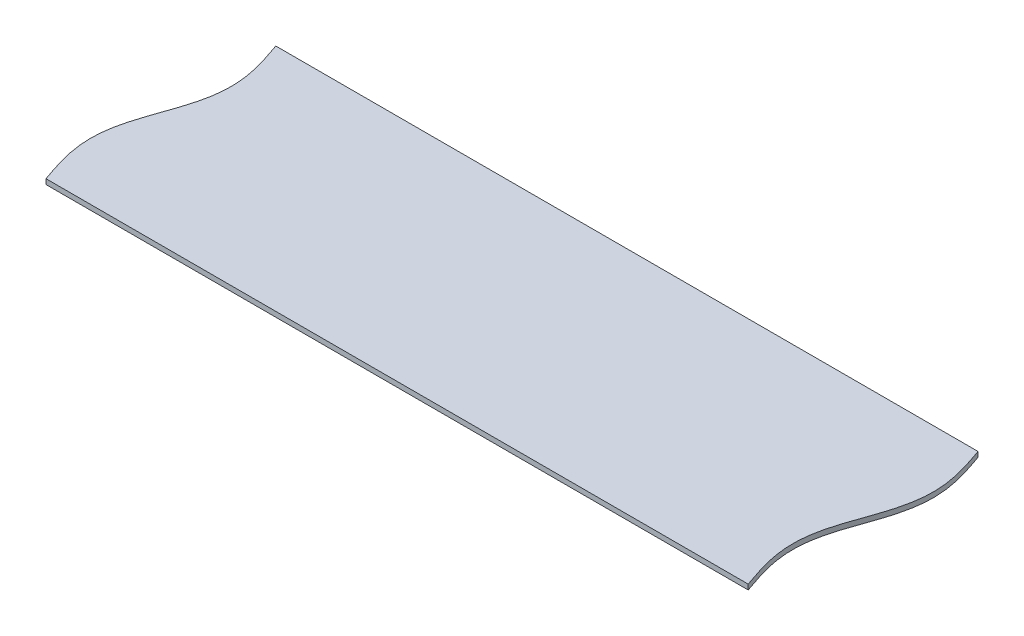
from build123d import *

# Parameters (mm, degrees)
BOSS_EXTRUDE1_DEPTH = 0.4


with BuildPart() as part:
    # Sketch1 → Boss-Extrude1 (new body)
    with BuildSketch(Plane(origin=(0, 0, 0), x_dir=(1, 0, 0), z_dir=(0, 1, 0))):
        with BuildLine():
            Line((0, 0), (55, 0))
            add(Edge.make_bspline(
                [(55, 0), (55.039665895, -0.11362906), (55.127828783, -0.366251213), (55.314067233, -0.905134946), (55.447833384, -1.324433303), (55.628652948, -1.92673847), (55.760019444, -2.450220955), (55.886445316, -3.059977501), (55.96864422, -3.682291541), (56.009573569, -4.325950267), (55.997152388, -4.960850874), (55.937709737, -5.59879764), (55.832282967, -6.227382827), (55.653956328, -7.005059201), (55.379683242, -7.921385768), (55.010484997, -8.974835885), (54.637099515, -10.03406897), (54.358100832, -10.958556195), (54.17500872, -11.74266605), (54.067304208, -12.380419561), (54.004765193, -13.014760212), (53.992375448, -13.655474375), (54.027833685, -14.28923275), (54.103689584, -14.849735384), (54.181675783, -15.270577843), (54.256538187, -15.59642759), (54.340386039, -15.95569417), (54.49812362, -16.501397065), (54.626404098, -16.921778114), (54.868150927, -17.622263401), (54.95612701, -17.874315955), (55, -18)],
                knots=[0.085661925, 0.085661925, 0.085661925, 0.085661925, 0.085661925, 0.111326291, 0.139967508, 0.162510207, 0.185052906, 0.213694134, 0.242335335, 0.270976523, 0.299617709, 0.328258916, 0.356900078, 0.385541278, 0.414182527, 0.471334271, 0.528616704, 0.58589912, 0.615912527, 0.644553724, 0.673194931, 0.701836107, 0.730477286, 0.7591185, 0.787759673, 0.802080278, 0.80924058, 0.816400883, 0.859983468, 0.888624685, 0.917265902, 0.917265902, 0.917265902, 0.917265902, 0.917265902], degree=4))
            Line((55, -18), (0, -18))
            add(Edge.make_bspline(
                [(0, 0), (0.039665895, -0.11362906), (0.127828783, -0.366251213), (0.314067233, -0.905134946), (0.447833384, -1.324433303), (0.628652948, -1.92673847), (0.760019444, -2.450220955), (0.886445316, -3.059977501), (0.96864422, -3.682291541), (1.009573569, -4.325950267), (0.997152388, -4.960850874), (0.937709737, -5.59879764), (0.832282967, -6.227382827), (0.653956328, -7.005059201), (0.379683242, -7.921385768), (0.010484997, -8.974835885), (-0.362900485, -10.03406897), (-0.641899168, -10.958556195), (-0.82499128, -11.74266605), (-0.932695792, -12.380419561), (-0.995234806, -13.014760212), (-1.007624552, -13.655474376), (-0.972166315, -14.28923275), (-0.896310416, -14.849735384), (-0.818324217, -15.270577843), (-0.743461813, -15.59642759), (-0.659613961, -15.95569417), (-0.50187638, -16.501397065), (-0.373595902, -16.921778114), (-0.131849073, -17.622263401), (-0.04387299, -17.874315955), (0, -18)],
                knots=[0.085661925, 0.085661925, 0.085661925, 0.085661925, 0.085661925, 0.111326291, 0.139967508, 0.162510207, 0.185052906, 0.213694134, 0.242335335, 0.270976523, 0.299617709, 0.328258916, 0.356900078, 0.385541278, 0.414182527, 0.471334271, 0.528616704, 0.58589912, 0.615912527, 0.644553724, 0.673194931, 0.701836107, 0.730477286, 0.7591185, 0.787759673, 0.802080278, 0.80924058, 0.816400883, 0.859983468, 0.888624685, 0.917265902, 0.917265902, 0.917265902, 0.917265902, 0.917265902], degree=4))
        make_face()
    extrude(amount=BOSS_EXTRUDE1_DEPTH)


solid = part.part
